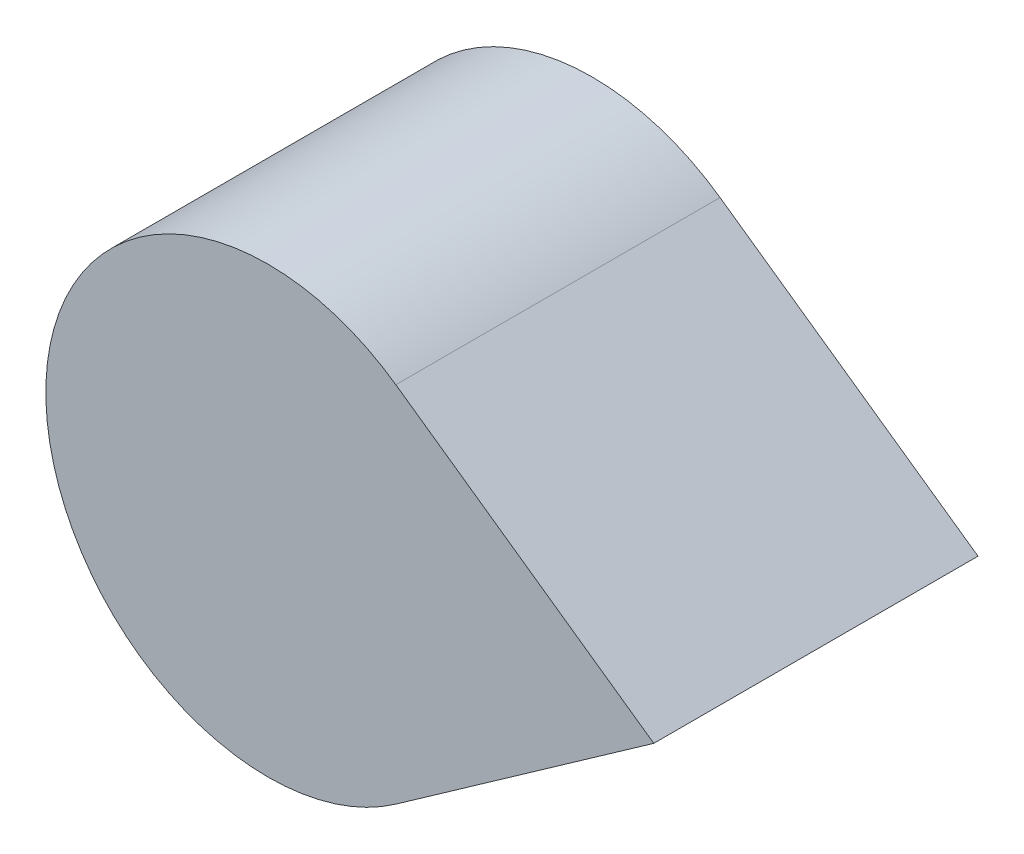
from build123d import *

# Parameters (mm, degrees)
BOSS_EXTRUDE1_DEPTH = 4.5


with BuildPart() as part:
    # Sketch1 → Boss-Extrude1 (new body)
    with BuildSketch(Plane.XY):
        with BuildLine():
            Line((21.972403267, 0.380941893), (25.552756565, 2.901675578))
            Line((25.552756565, 2.901675578), (21.972515744, 5.422569014))
            ThreePointArc((21.972515744, 5.422569014), (17.114652686, 2.90186383), (21.972403267, 0.380941893))
        make_face()
    extrude(amount=-BOSS_EXTRUDE1_DEPTH)


solid = part.part
